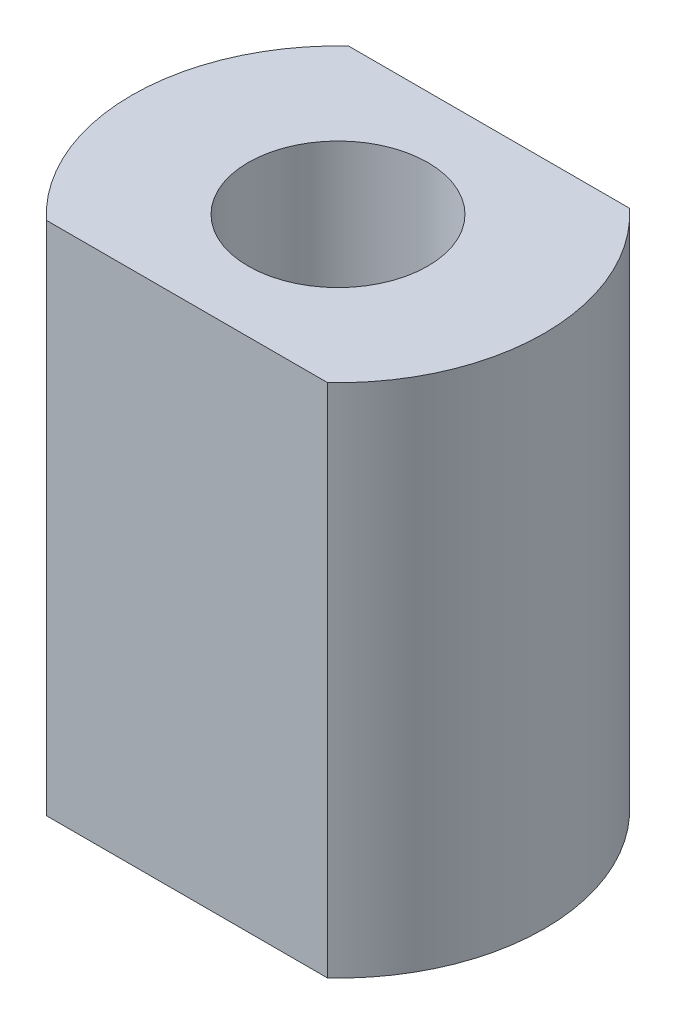
from build123d import *

# Parameters (mm, degrees)
BOSS_EXTRUDE1_DEPTH   = 7
F_2_CLEARANCE_HOLE1_D = 2.4384


with BuildPart() as part:
    # Sketch1 → Boss-Extrude1 (new body)
    with BuildSketch(Plane(origin=(0, 0, 0), x_dir=(1, 0, 0), z_dir=(0, 1, 0))):
        with BuildLine():
            Line((-1.907223112, 2.05), (1.907223112, 2.05))
            ThreePointArc((1.907223112, 2.05), (2.8, 0), (1.907223112, -2.05))
            Line((1.907223112, -2.05), (-1.907223112, -2.05))
            ThreePointArc((-1.907223112, -2.05), (-2.8, 0), (-1.907223112, 2.05))
        make_face()
    extrude(amount=BOSS_EXTRUDE1_DEPTH)

    # #2 Clearance Hole1 (through all)
    with Locations(Plane(origin=(0, 7, 0), x_dir=(1, 0, 0), z_dir=(0, 1, 0))):
        with Locations((0, 0)):
            Hole(F_2_CLEARANCE_HOLE1_D / 2)


solid = part.part
